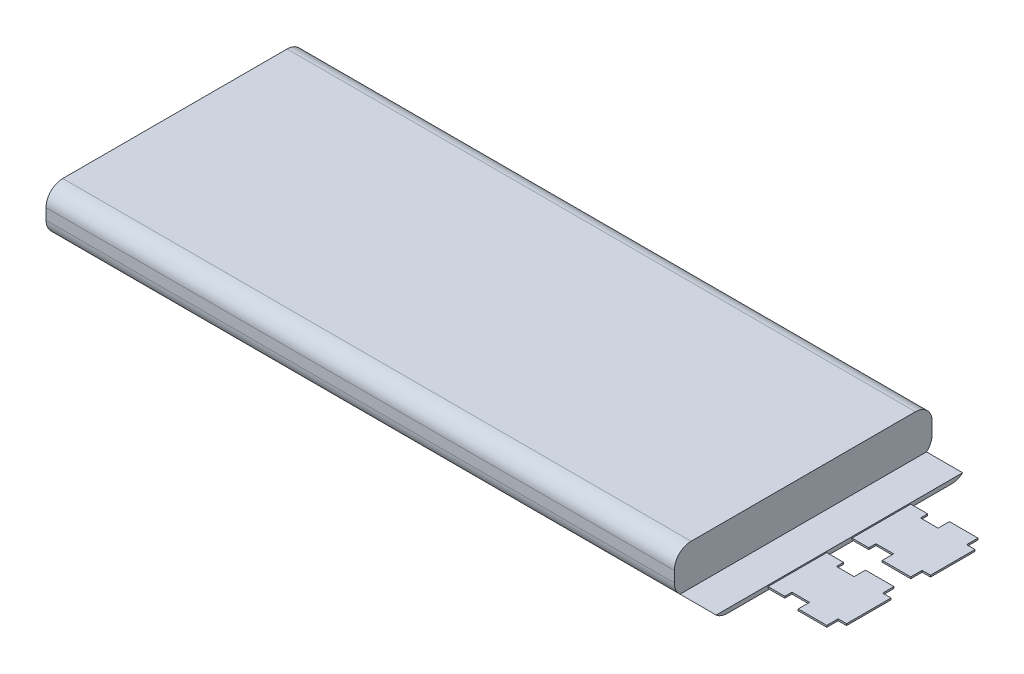
from build123d import *

# Parameters (mm, degrees)
SKETCH1_W           = 79.1
SKETCH1_H           = 30.7
BOSS_EXTRUDE1_DEPTH = 5.3
FILLET1_R           = 2
SKETCH2_W           = 4.3
SKETCH2_H           = 30.7
CUT_EXTRUDE1_DEPTH  = 4.8
BOSS_EXTRUDE2_DEPTH = 0.1


with BuildPart() as part:
    # Sketch1 → Boss-Extrude1 (new body)
    with BuildSketch(Plane(origin=(0, 0, 0), x_dir=(1, 0, 0), z_dir=(0, 1, 0))):
        Rectangle(SKETCH1_W, SKETCH1_H)
    extrude(amount=BOSS_EXTRUDE1_DEPTH)

    # Fillet1
    fillet1_edges = [part.edges().sort_by_distance(p)[0] for p in [
        (0, 5.3, -15.35),
        (0, 0, -15.35),
        (0, 0, 15.35),
        (0, 5.3, 15.35),
    ]]
    fillet(fillet1_edges, radius=FILLET1_R)

    # Sketch2 → Cut-Extrude1 (cut)
    with BuildSketch(Plane(origin=(0, 5.3, 0), x_dir=(1, 0, 0), z_dir=(0, 1, 0))):
        with Locations((37.4, 0)):
            Rectangle(SKETCH2_W, SKETCH2_H)
    extrude(amount=-CUT_EXTRUDE1_DEPTH, mode=Mode.SUBTRACT)

    # Sketch3 → Boss-Extrude2 (add, symmetric)
    with BuildSketch(Plane(origin=(0, 0.25, 0), x_dir=(1, 0, 0), z_dir=(0, 1, 0))):
        Polygon((39.55, 8.5), (41.55, 8.5), (41.55, 7.65), (43.65, 7.65), (43.65, 9), (47.05, 9), (47.05, 7.65), (48.05, 7.65), (48.05, 2.35), (47.05, 2.35), (47.05, 1), (43.65, 1), (43.65, 2.35), (41.55, 2.35), (41.55, 1.5), (39.55, 1.5), align=None)
    boss_extrude2 = extrude(amount=BOSS_EXTRUDE2_DEPTH, both=True)

    # Mirror1: Boss-Extrude2 across plane
    add(boss_extrude2.mirror(Plane.XY))


solid = part.part
